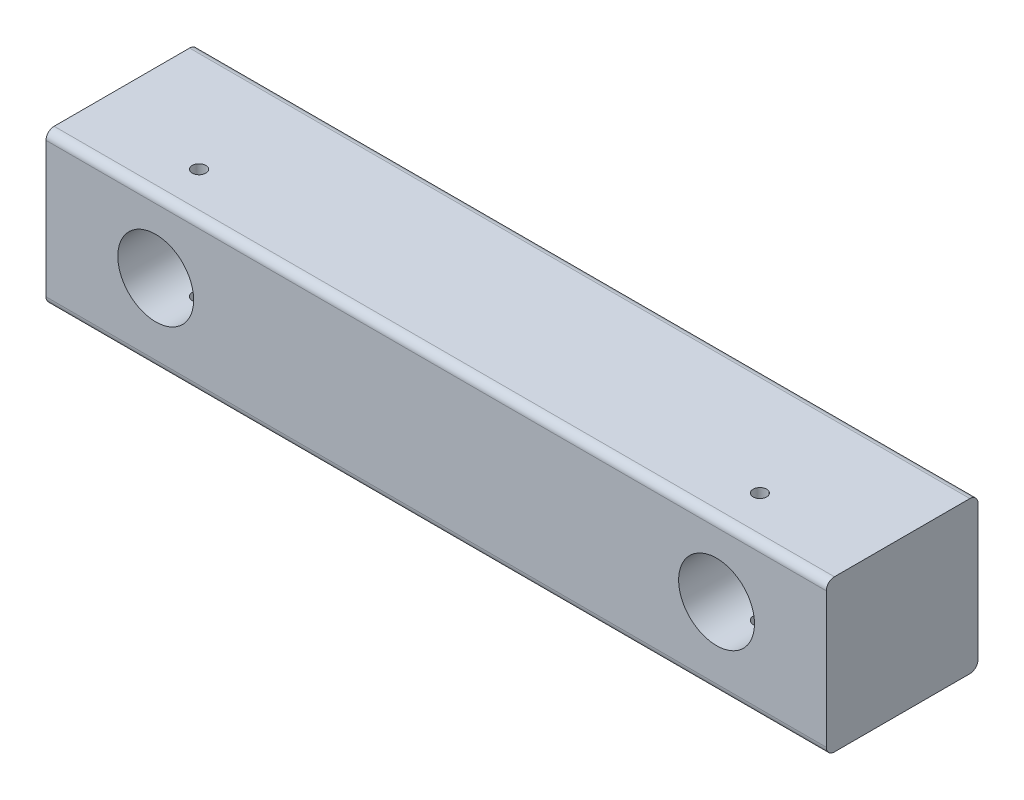
from build123d import *

# Parameters (mm, degrees)
SKETCH1_W                      = 457.2
SKETCH1_H                      = 88.9
BOSS_EXTRUDE1_DEPTH            = 88.9
SKETCH2_R                      = 22.225
CUT_EXTRUDE1_DEPTH             = 623.36503358
F_5_16_0_3125_DIAMETER_HOLE1_D = 7.9375
FILLET1_R                      = 4.7625


with BuildPart() as part:
    # Sketch1 → Boss-Extrude1 (new body)
    with BuildSketch(Plane.XY):
        with Locations((0, -527.543937925)):
            Rectangle(SKETCH1_W, SKETCH1_H)
    extrude(amount=-BOSS_EXTRUDE1_DEPTH)

    # Sketch2 → Cut-Extrude1 (cut, through all)
    with BuildSketch(Plane.XY):
        with Locations((164.309496882, -525.607187925)):
            Circle(SKETCH2_R)
        with Locations((-164.309496882, -525.607187925)):
            Circle(SKETCH2_R)
    extrude(amount=-CUT_EXTRUDE1_DEPTH, mode=Mode.SUBTRACT)

    # 5/16 (0.3125) Diameter Hole1 (through all)
    with Locations(Plane(origin=(0, -483.093937925, 0), x_dir=(1, 0, 0), z_dir=(0, 1, 0))):
        with Locations((-164.309496882, 25.4), (164.309496882, 25.4)):
            Hole(F_5_16_0_3125_DIAMETER_HOLE1_D / 2)

    # Fillet1
    fillet1_edges = [part.edges().sort_by_distance(p)[0] for p in [
        (0, -483.093937925, 0),
        (0, -571.993937925, -88.9),
        (0, -483.093937925, -88.9),
        (0, -571.993937925, 0),
    ]]
    fillet(fillet1_edges, radius=FILLET1_R)


solid = part.part
